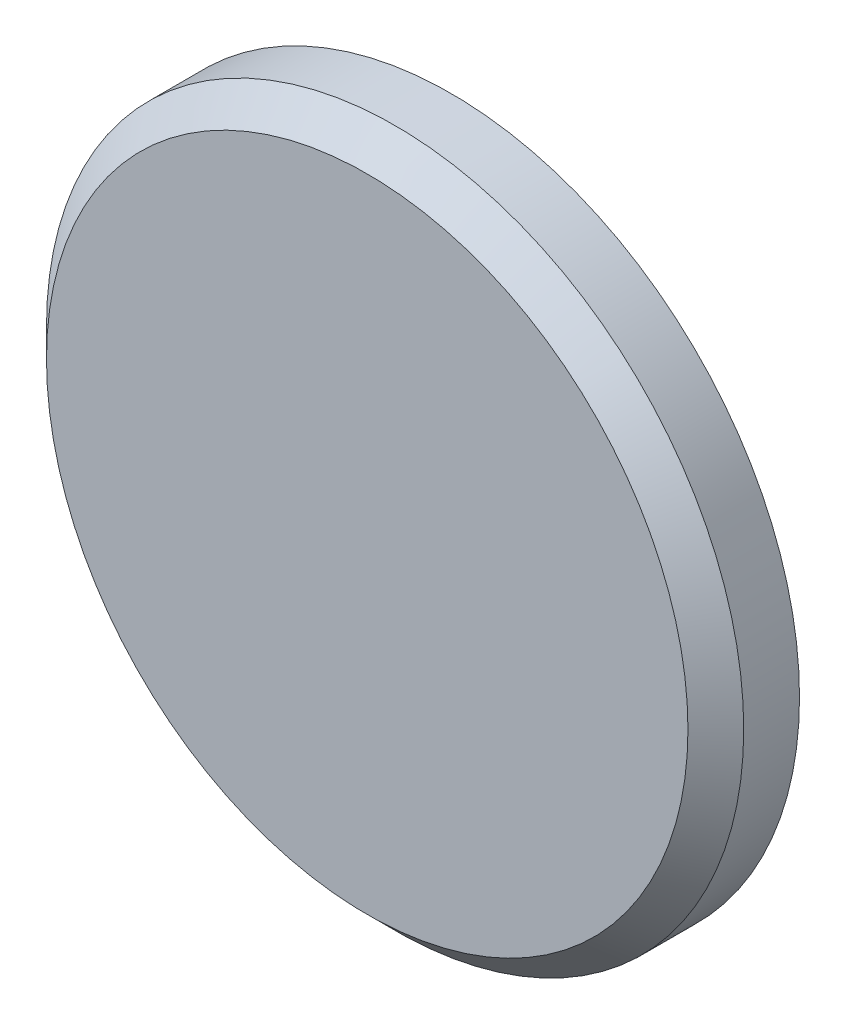
from build123d import *

# Parameters (mm, degrees)
ESBO_O1_R                = 12.5
RESSALTO_EXTRUS_O1_DEPTH = 3
CHANFRO1_SIZE            = 1


with BuildPart() as part:
    # Esboço1 → Ressalto-extrusão1 (new body)
    with BuildSketch(Plane.XY):
        with Locations((132.424161544, 100)):
            Circle(ESBO_O1_R)
    extrude(amount=RESSALTO_EXTRUS_O1_DEPTH)

    # Chanfro1
    chanfro1_edges = [part.edges().sort_by_distance(p)[0] for p in [
        (119.924161544, 100, 3),
    ]]
    chamfer(chanfro1_edges, length=CHANFRO1_SIZE)


solid = part.part
